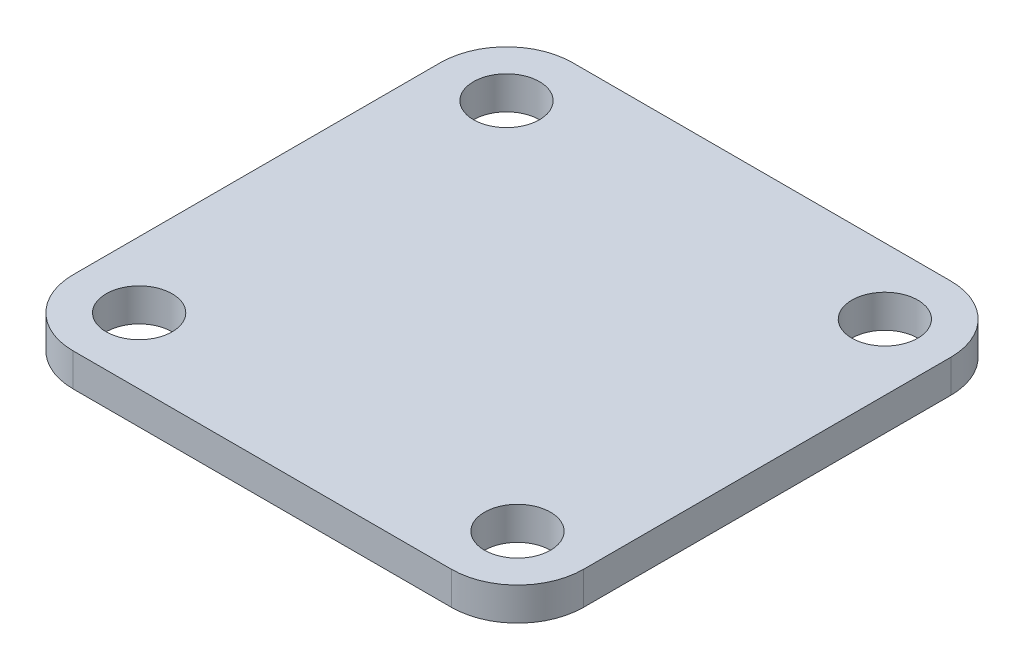
from build123d import *

# Parameters (mm, degrees)
SKETCH1_W           = 23.2
SKETCH1_H           = 22.7
BOSS_EXTRUDE1_DEPTH = 1.5
FILLET1_R           = 3
SKETCH2_R           = 1.5
CUT_EXTRUDE1_DEPTH  = 17.298236101


with BuildPart() as part:
    # Sketch1 → Boss-Extrude1 (new body)
    with BuildSketch(Plane(origin=(0, 0, 0), x_dir=(1, 0, 0), z_dir=(0, 1, 0))):
        Rectangle(SKETCH1_W, SKETCH1_H)
    extrude(amount=BOSS_EXTRUDE1_DEPTH)

    # Fillet1
    fillet1_edges = [part.edges().sort_by_distance(p)[0] for p in [
        (11.6, 0.75, 11.35),
        (-11.6, 0.75, 11.35),
        (-11.6, 0.75, -11.35),
        (11.6, 0.75, -11.35),
    ]]
    fillet(fillet1_edges, radius=FILLET1_R)

    # Sketch2 → Cut-Extrude1 (cut, through all)
    with BuildSketch(Plane(origin=(0, 1.5, 0), x_dir=(1, 0, 0), z_dir=(0, 1, 0))):
        with Locations(Location((-8.6, 8.35, 0), (0, 0, 270))):
            Circle(SKETCH2_R)
        with Locations(Location((8.6, 8.35, 0), (0, 0, 270))):
            Circle(SKETCH2_R)
        with Locations(Location((8.6, -8.35, 0), (0, 0, 270))):
            Circle(SKETCH2_R)
        with Locations(Location((-8.6, -8.35, 0), (0, 0, 270))):
            Circle(SKETCH2_R)
    extrude(amount=-CUT_EXTRUDE1_DEPTH, mode=Mode.SUBTRACT)


solid = part.part
